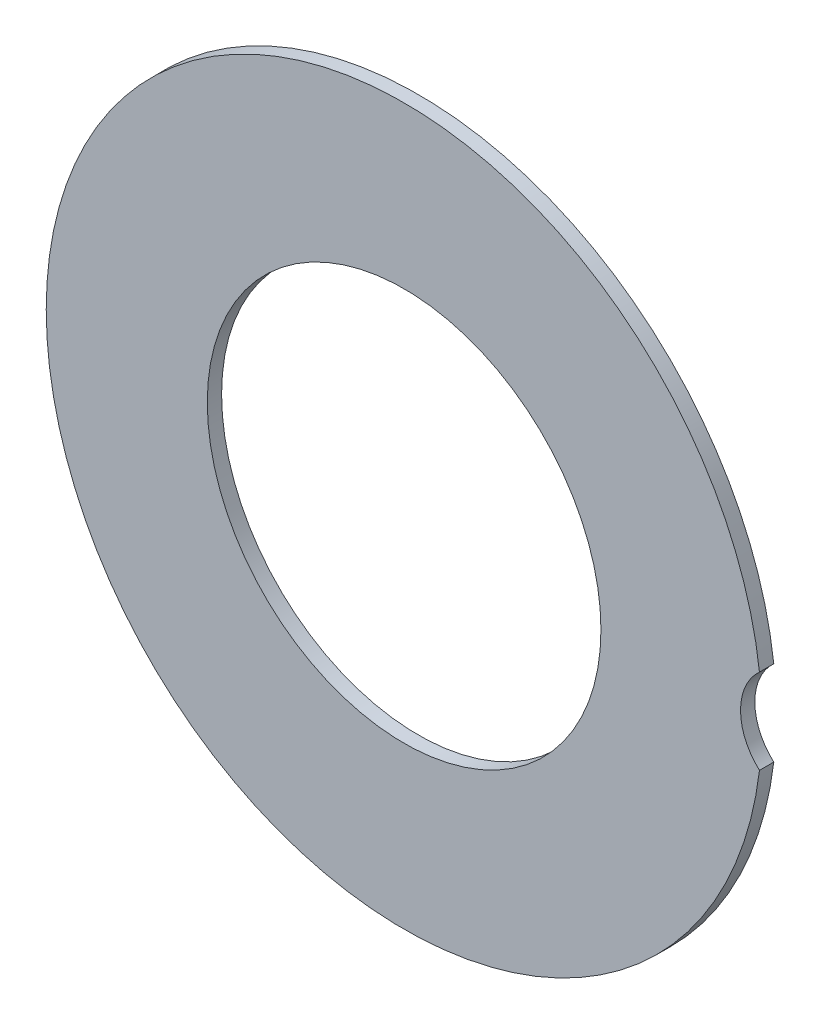
from build123d import *

# Parameters (mm, degrees)
SKETCH1_R           = 100
SKETCH1_R_2         = 55
BOSS_EXTRUDE1_DEPTH = 4
SKETCH2_R           = 16
CUT_EXTRUDE2_DEPTH  = 5


with BuildPart() as part:
    # Sketch1 → Boss-Extrude1 (new body)
    with BuildSketch(Plane.XY):
        Circle(SKETCH1_R)
        Circle(SKETCH1_R_2, mode=Mode.SUBTRACT)
    extrude(amount=BOSS_EXTRUDE1_DEPTH)

    # Sketch2 → Cut-Extrude2 (cut)
    with BuildSketch(Plane.XY):
        with Locations((110, 0)):
            Circle(SKETCH2_R)
    extrude(amount=CUT_EXTRUDE2_DEPTH, mode=Mode.SUBTRACT)


solid = part.part
